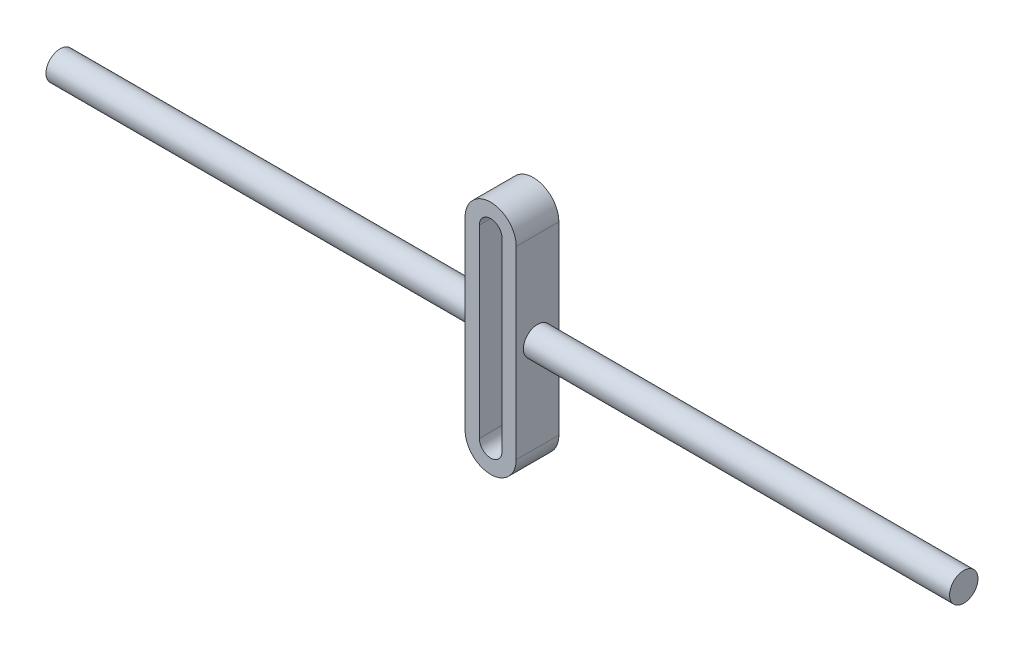
from build123d import *

# Parameters (mm, degrees)
BOSS_EXTRUDE1_DEPTH = 15
SKETCH2_R           = 5
BOSS_EXTRUDE2_DEPTH = 150


with BuildPart() as part:
    # Sketch1 → Boss-Extrude1 (new body)
    with BuildSketch(Plane.XY):
        with BuildLine():
            Line((-9, 0), (-9, 65))
            ThreePointArc((-9, 65), (0, 74), (9, 65))
            Line((9, 65), (9, 0))
            ThreePointArc((9, 0), (0, -9), (-9, 0))
        make_face()
        with BuildLine():
            Line((-4, 0), (-4, 65))
            ThreePointArc((-4, 65), (0, 69), (4, 65))
            Line((4, 65), (4, 0))
            ThreePointArc((4, 0), (0, -4), (-4, 0))
        make_face(mode=Mode.SUBTRACT)
    extrude(amount=BOSS_EXTRUDE1_DEPTH)

    # Sketch2 → Boss-Extrude2 (add)
    with BuildSketch(Plane(origin=(9, 0, 0), x_dir=(0, 0, -1), z_dir=(1, 0, 0))):
        with Locations(Location((-7.5, 32.5, 0), (0, 0, 180))):
            Circle(SKETCH2_R)
    boss_extrude2 = extrude(amount=BOSS_EXTRUDE2_DEPTH)

    # Mirror1: Boss-Extrude2 across plane
    add(boss_extrude2.mirror(Plane(origin=(0, 0, 0), x_dir=(0, 0, 1), z_dir=(1, 0, 0))))


solid = part.part
